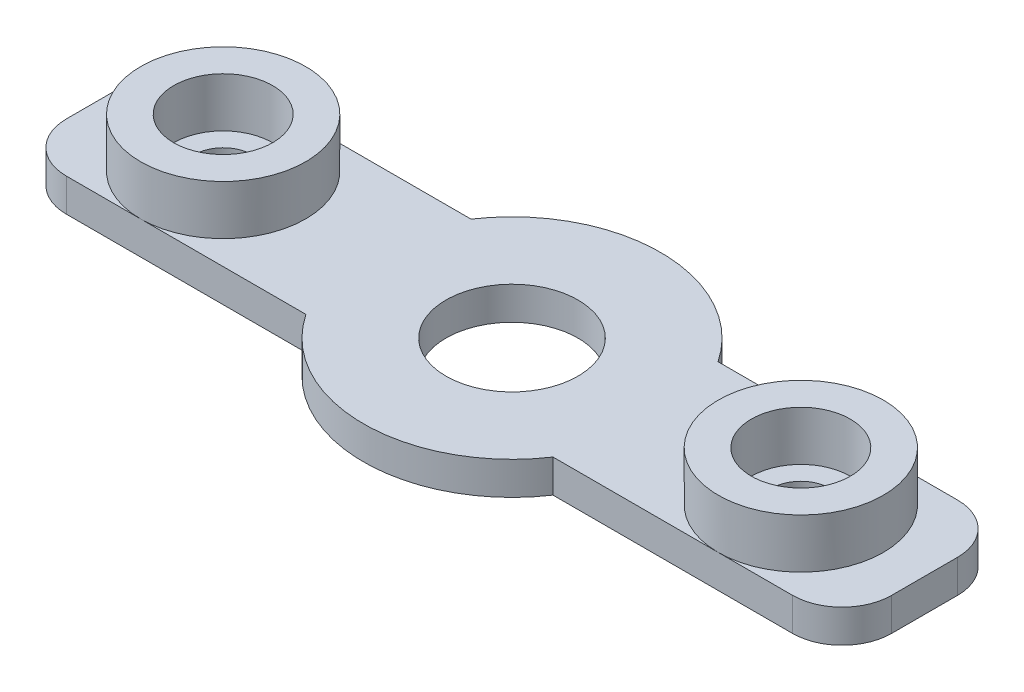
from build123d import *

# Parameters (mm, degrees)
SKETCH1_R           = 1.75
SKETCH1_R_2         = 4
BOSS_EXTRUDE1_DEPTH = 2
FILLET1_R           = 3
SKETCH2_R           = 5
SKETCH2_R_2         = 3
BOSS_EXTRUDE2_DEPTH = 3


with BuildPart() as part:
    # Sketch1 → Boss-Extrude1 (new body)
    with BuildSketch(Plane(origin=(0, 0, 0), x_dir=(1, 0, 0), z_dir=(0, 1, 0))):
        with BuildLine():
            Line((-7.483314774, 5), (-25, 5))
            Line((-25, 5), (-25, -5))
            Line((-25, -5), (-7.483314774, -5))
            ThreePointArc((-7.483314774, -5), (0, -9), (7.483314774, -5))
            Line((7.483314774, -5), (25, -5))
            Line((25, -5), (25, 5))
            Line((25, 5), (7.483314774, 5))
            ThreePointArc((7.483314774, 5), (0, 9), (-7.483314774, 5))
        make_face()
        with Locations((-17.5, 0)):
            Circle(SKETCH1_R, mode=Mode.SUBTRACT)
        Circle(SKETCH1_R_2, mode=Mode.SUBTRACT)
        with Locations((17.5, 0)):
            Circle(SKETCH1_R, mode=Mode.SUBTRACT)
    extrude(amount=BOSS_EXTRUDE1_DEPTH)

    # Fillet1
    fillet1_edges = [part.edges().sort_by_distance(p)[0] for p in [
        (-25, 1, -5),
        (25, 1, -5),
        (25, 1, 5),
        (-25, 1, 5),
    ]]
    fillet(fillet1_edges, radius=FILLET1_R)

    # Sketch2 → Boss-Extrude2 (add)
    # profile 1 of 2: a face of its own
    with BuildSketch(Plane(origin=(0, 2, 0), x_dir=(1, 0, 0), z_dir=(0, 1, 0))):
        with Locations((-17.5, 0)):
            Circle(SKETCH2_R)
        with Locations((-17.5, 0)):
            Circle(SKETCH2_R_2, mode=Mode.SUBTRACT)
    # profile 2 of 2: a face of its own
    with BuildSketch(Plane(origin=(0, 2, 0), x_dir=(1, 0, 0), z_dir=(0, 1, 0))):
        with Locations((17.5, 0)):
            Circle(SKETCH2_R)
        with Locations((17.5, 0)):
            Circle(SKETCH2_R_2, mode=Mode.SUBTRACT)
    extrude(amount=BOSS_EXTRUDE2_DEPTH)


solid = part.part
